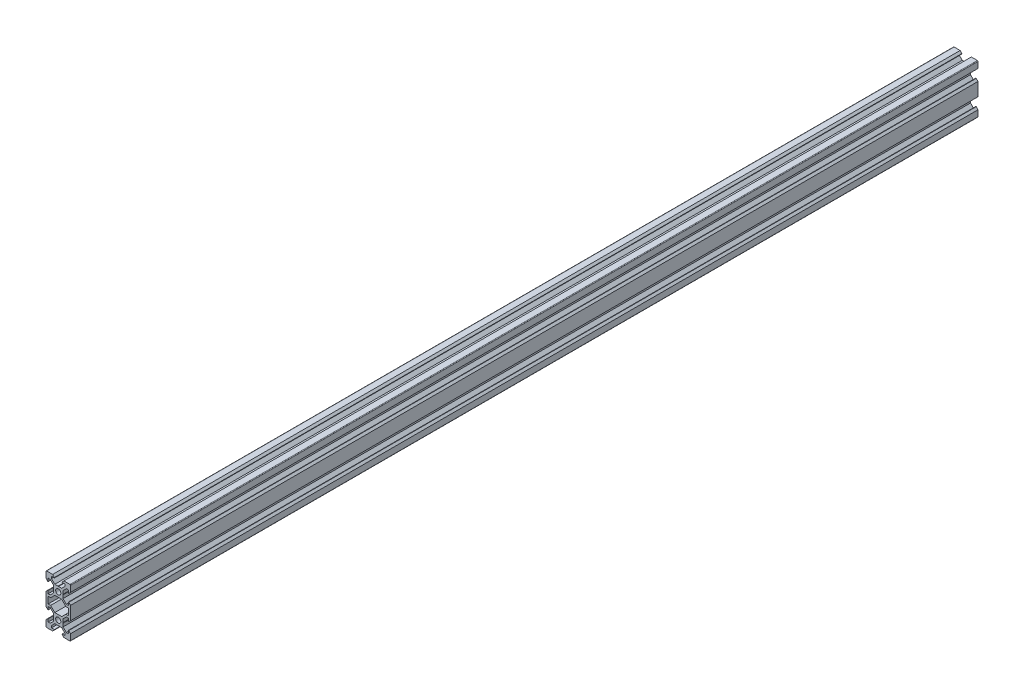
from build123d import *

# Parameters (mm, degrees)
SKETCH1_R           = 2.1
BOSS_EXTRUDE1_DEPTH = 740


with BuildPart() as part:
    # Sketch1 → Boss-Extrude1 (new body)
    with BuildSketch(Plane.XY):
        with BuildLine():
            Line((4.58, -20), (9.5, -20))
            ThreePointArc((9.5, -20), (9.853553391, -19.853553391), (10, -19.5))
            Line((10, -19.5), (10, -14.58))
            Line((10, -14.58), (8.545, -13.125))
            Line((8.545, -13.125), (8.2, -13.125))
            Line((8.2, -13.125), (8.2, -15.5))
            Line((8.2, -15.5), (6.560660172, -15.5))
            Line((6.560660172, -15.5), (3.9, -12.839339828))
            Line((3.9, -12.839339828), (3.9, -10.21))
            Line((3.9, -10.21), (3.69, -10))
            Line((3.69, -10), (3.9, -9.79))
            Line((3.9, -9.79), (3.9, -7.160660172))
            Line((3.9, -7.160660172), (6.560660172, -4.5))
            Line((6.560660172, -4.5), (8.2, -4.5))
            Line((8.2, -4.5), (8.2, -6.875))
            Line((8.2, -6.875), (8.545, -6.875))
            Line((8.545, -6.875), (10, -5.42))
            Line((10, -5.42), (10, 5.42))
            Line((10, 5.42), (8.545, 6.875))
            Line((8.545, 6.875), (8.2, 6.875))
            Line((8.2, 6.875), (8.2, 4.5))
            Line((8.2, 4.5), (6.560660172, 4.5))
            Line((6.560660172, 4.5), (3.9, 7.160660172))
            Line((3.9, 7.160660172), (3.9, 9.79))
            Line((3.9, 9.79), (3.69, 10))
            Line((3.69, 10), (3.9, 10.21))
            Line((3.9, 10.21), (3.9, 12.839339828))
            Line((3.9, 12.839339828), (6.560660172, 15.5))
            Line((6.560660172, 15.5), (8.2, 15.5))
            Line((8.2, 15.5), (8.2, 13.125))
            Line((8.2, 13.125), (8.545, 13.125))
            Line((8.545, 13.125), (10, 14.58))
            Line((10, 14.58), (10, 19.5))
            ThreePointArc((10, 19.5), (9.853553391, 19.853553391), (9.5, 20))
            Line((9.5, 20), (4.58, 20))
            Line((4.58, 20), (3.125, 18.545))
            Line((3.125, 18.545), (3.125, 18.2))
            Line((3.125, 18.2), (5.5, 18.2))
            Line((5.5, 18.2), (5.5, 16.560660172))
            Line((5.5, 16.560660172), (2.839339828, 13.9))
            Line((2.839339828, 13.9), (0.21, 13.9))
            Line((0.21, 13.9), (0, 13.69))
            Line((0, 13.69), (-0.21, 13.9))
            Line((-0.21, 13.9), (-2.839339828, 13.9))
            Line((-2.839339828, 13.9), (-5.5, 16.560660172))
            Line((-5.5, 16.560660172), (-5.5, 18.2))
            Line((-5.5, 18.2), (-3.125, 18.2))
            Line((-3.125, 18.2), (-3.125, 18.545))
            Line((-3.125, 18.545), (-4.58, 20))
            Line((-4.58, 20), (-9.5, 20))
            ThreePointArc((-9.5, 20), (-9.853553391, 19.853553391), (-10, 19.5))
            Line((-10, 19.5), (-10, 14.58))
            Line((-10, 14.58), (-8.545, 13.125))
            Line((-8.545, 13.125), (-8.2, 13.125))
            Line((-8.2, 13.125), (-8.2, 15.5))
            Line((-8.2, 15.5), (-6.560660172, 15.5))
            Line((-6.560660172, 15.5), (-3.9, 12.839339828))
            Line((-3.9, 12.839339828), (-3.9, 10.21))
            Line((-3.9, 10.21), (-3.69, 10))
            Line((-3.69, 10), (-3.9, 9.79))
            Line((-3.9, 9.79), (-3.9, 7.160660172))
            Line((-3.9, 7.160660172), (-6.560660172, 4.5))
            Line((-6.560660172, 4.5), (-8.2, 4.5))
            Line((-8.2, 4.5), (-8.2, 6.875))
            Line((-8.2, 6.875), (-8.545, 6.875))
            Line((-8.545, 6.875), (-10, 5.42))
            Line((-10, 5.42), (-10, -5.42))
            Line((-10, -5.42), (-8.545, -6.875))
            Line((-8.545, -6.875), (-8.2, -6.875))
            Line((-8.2, -6.875), (-8.2, -4.5))
            Line((-8.2, -4.5), (-6.560660172, -4.5))
            Line((-6.560660172, -4.5), (-3.9, -7.160660172))
            Line((-3.9, -7.160660172), (-3.9, -9.79))
            Line((-3.9, -9.79), (-3.69, -10))
            Line((-3.69, -10), (-3.9, -10.21))
            Line((-3.9, -10.21), (-3.9, -12.839339828))
            Line((-3.9, -12.839339828), (-6.560660172, -15.5))
            Line((-6.560660172, -15.5), (-8.2, -15.5))
            Line((-8.2, -15.5), (-8.2, -13.125))
            Line((-8.2, -13.125), (-8.545, -13.125))
            Line((-8.545, -13.125), (-10, -14.58))
            Line((-10, -14.58), (-10, -19.5))
            ThreePointArc((-10, -19.5), (-9.853553391, -19.853553391), (-9.5, -20))
            Line((-9.5, -20), (-4.58, -20))
            Line((-4.58, -20), (-3.125, -18.545))
            Line((-3.125, -18.545), (-3.125, -18.2))
            Line((-3.125, -18.2), (-5.5, -18.2))
            Line((-5.5, -18.2), (-5.5, -16.560660172))
            Line((-5.5, -16.560660172), (-2.839339828, -13.9))
            Line((-2.839339828, -13.9), (-0.21, -13.9))
            Line((-0.21, -13.9), (0, -13.69))
            Line((0, -13.69), (0.21, -13.9))
            Line((0.21, -13.9), (2.839339828, -13.9))
            Line((2.839339828, -13.9), (5.5, -16.560660172))
            Line((5.5, -16.560660172), (5.5, -18.2))
            Line((5.5, -18.2), (3.125, -18.2))
            Line((3.125, -18.2), (3.125, -18.545))
            Line((3.125, -18.545), (4.58, -20))
        make_face()
        with Locations((0, -10)):
            Circle(SKETCH1_R, mode=Mode.SUBTRACT)
        Polygon((-6.239339828, -2.7), (-8.2, -2.7), (-8.2, 2.7), (-6.239339828, 2.7), (-2.839339828, 6.1), (2.839339828, 6.1), (6.239339828, 2.7), (8.2, 2.7), (8.2, -2.7), (6.239339828, -2.7), (2.839339828, -6.1), (-2.839339828, -6.1), align=None, mode=Mode.SUBTRACT)
        with Locations((0, 10)):
            Circle(SKETCH1_R, mode=Mode.SUBTRACT)
    extrude(amount=BOSS_EXTRUDE1_DEPTH)


solid = part.part
